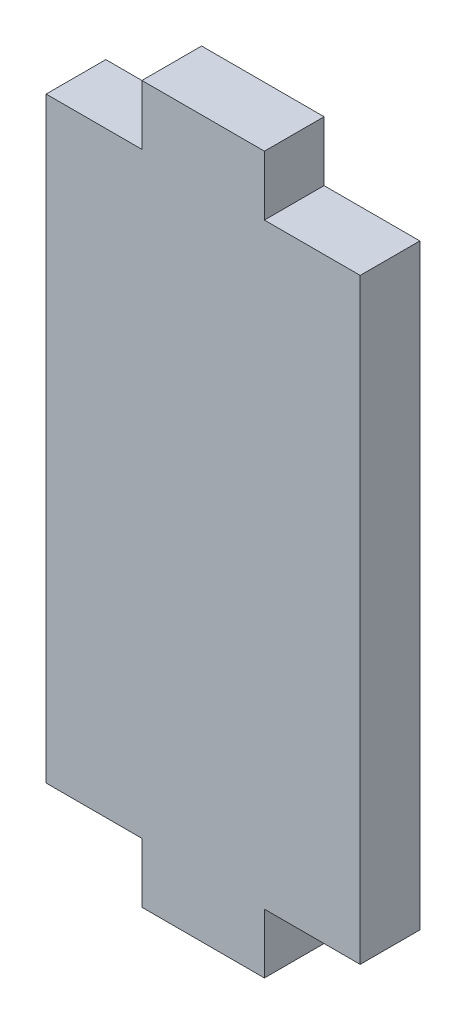
from build123d import *

# Parameters (mm, degrees)
SKETCH1_W           = 25.4
SKETCH1_H           = 57.912
BOSS_EXTRUDE1_DEPTH = 4.826
SKETCH2_W           = 7.747
SKETCH2_H           = 4.826
CUT_EXTRUDE1_DEPTH  = 64.421211121


with BuildPart() as part:
    # Sketch1 → Boss-Extrude1 (new body)
    with BuildSketch(Plane.XY):
        with Locations((12.7, 28.956)):
            Rectangle(SKETCH1_W, SKETCH1_H)
    extrude(amount=BOSS_EXTRUDE1_DEPTH)

    # Sketch2 → Cut-Extrude1 (cut, through all)
    with BuildSketch(Plane.XY.offset(4.826)):
        with Locations((21.5265, 55.499)):
            Rectangle(SKETCH2_W, SKETCH2_H)
        with Locations((3.8735, 55.499)):
            Rectangle(SKETCH2_W, SKETCH2_H)
        with Locations((21.5265, 2.413)):
            Rectangle(SKETCH2_W, SKETCH2_H)
        with Locations((3.8735, 2.413)):
            Rectangle(SKETCH2_W, SKETCH2_H)
    extrude(amount=-CUT_EXTRUDE1_DEPTH, mode=Mode.SUBTRACT)


solid = part.part
